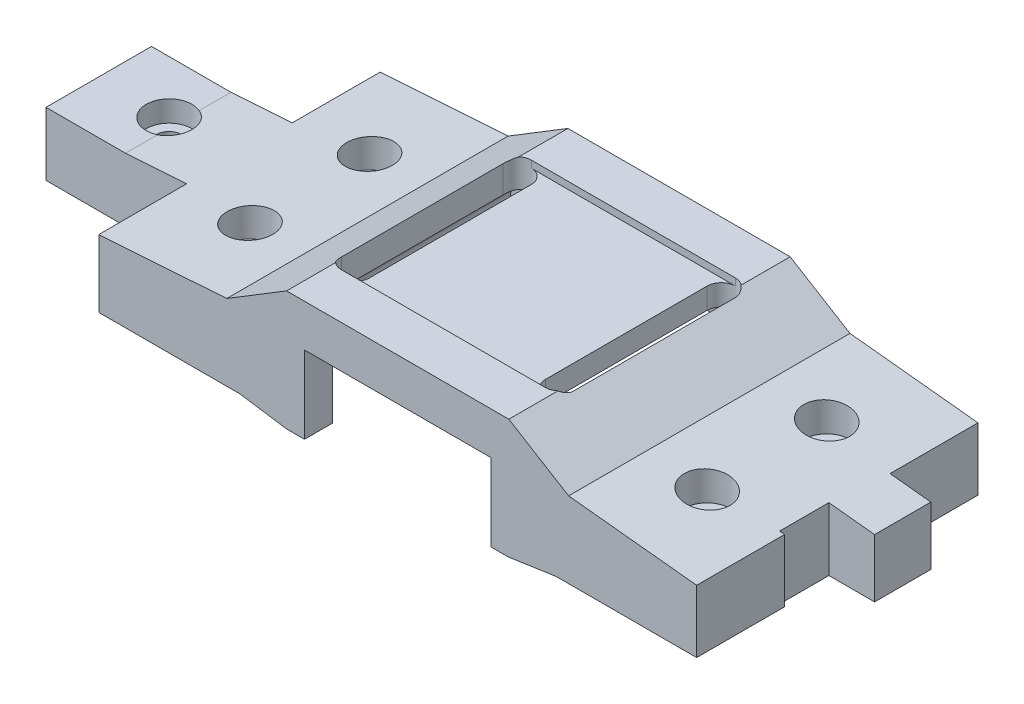
from build123d import *
from build123d.topology import SkipClean

# Parameters (mm, degrees)
SKETCH1_R                      = 1.8
BOSS_EXTRUDE1_DEPTH            = 6
BOSS_EXTRUDE2_REACH            = 76.446
CUT_EXTRUDE1_REACH             = 68.38
SKETCH3_R                      = 1.8
SKETCH3_W                      = 13.5
SKETCH3_H                      = 12.5
SKETCH4_R                      = 3.25
CUT_EXTRUDE2_DEPTH             = 10
CUT_EXTRUDE3_REACH             = 77.909
CUT_EXTRUDE4_START             = -2
SKETCH6_W                      = 35
SKETCH6_H                      = 27
CUT_EXTRUDE4_DEPTH             = 4.307692
FILLET1_R                      = 2
BOSS_EXTRUDE3_DEPTH            = 4
CUT_EXTRUDE5_REACH             = 68.897
CUT_EXTRUDE5_DIRECTION_2_REACH = 68.897
SKETCH9_W                      = 9.25
SKETCH9_H                      = 10
CUT_EXTRUDE6_DEPTH             = 32
SKETCH10_W                     = 29
SKETCH10_H                     = 27
CUT_EXTRUDE7_DEPTH             = 1
CUT_EXTRUDE8_DEPTH             = 67.379590252
CUT_EXTRUDE8_DEPTH_BACK        = 67.379590252
SKETCH11_W                     = 14.2
SKETCH11_H                     = 15
CUT_EXTRUDE9_REACH             = 69.544
SKETCH12_W                     = 6.5
SKETCH12_H                     = 7
CUT_EXTRUDE10_START            = -40
CUT_EXTRUDE10_DEPTH            = 40
BOSS_EXTRUDE4_START            = 3
BOSS_EXTRUDE4_DEPTH            = 3


with BuildPart() as part:
    # Sketch1 → Boss-Extrude1 (new body)
    with BuildSketch(Plane(origin=(0, 0, 0), x_dir=(1, 0, 0), z_dir=(0, 1, 0))):
        Polygon((42.5, 20), (42.5, 7.5), (62.5, 7.5), (62.5, -7.5), (42.5, -7.5), (42.5, -20), (-42.5, -20), (-42.5, -7.5), (-62.5, -7.5), (-62.5, 7.5), (-42.5, 7.5), (-42.5, 20), align=None)
        with Locations(Location((-52.5, 0, 0), (0, 0, 270))):
            Circle(SKETCH1_R, mode=Mode.SUBTRACT)
        with Locations(Location((-32.5, 8.5, 0), (0, 0, 270))):
            Circle(SKETCH1_R, mode=Mode.SUBTRACT)
        with Locations(Location((-32.5, -8.5, 0), (0, 0, 270))):
            Circle(SKETCH1_R, mode=Mode.SUBTRACT)
        with Locations(Location((32.5, -8.5, 0), (0, 0, 90))):
            Circle(SKETCH1_R, mode=Mode.SUBTRACT)
        with Locations(Location((52.5, 0, 0), (0, 0, 90))):
            Circle(SKETCH1_R, mode=Mode.SUBTRACT)
        with Locations(Location((32.5, 8.5, 0), (0, 0, 90))):
            Circle(SKETCH1_R, mode=Mode.SUBTRACT)
    extrude(amount=BOSS_EXTRUDE1_DEPTH)

    # Boss-Extrude2: up to this face of the body (flat: up to its plane)
    boss_extrude2_end = Plane(part.part.faces().sort_by_distance((0, 3, 20))[0])
    # Sketch2 → Boss-Extrude2 (add, up to the picked face)
    with BuildSketch(Plane(origin=(0, 0, -20), x_dir=(-1, 0, 0), z_dir=(0, 0, -1)), mode=Mode.PRIVATE) as boss_extrude2_sk1:
        Polygon((-56, 6), (-40, 16), (40, 16), (56, 6), align=None)
    boss_extrude2_tool1 = split(extrude(boss_extrude2_sk1.sketch, amount=-BOSS_EXTRUDE2_REACH, mode=Mode.PRIVATE), bisect_by=boss_extrude2_end, keep=Keep.BOTH, mode=Mode.PRIVATE)
    add(boss_extrude2_tool1.solids().sort_by(Axis((0, 10.722222, -20), (0, 0, 1)))[0])

    # Sketch3 → Cut-Extrude1 (cut, up to next)
    with BuildSketch(Plane.XZ.offset(-6), mode=Mode.PRIVATE) as cut_extrude1_sk1:
        with Locations(Location((52.5, 0, 0), (0, 0, 270))):
            Circle(SKETCH3_R)
    cut_extrude1_tool1 = extrude(cut_extrude1_sk1.sketch, amount=-CUT_EXTRUDE1_REACH, mode=Mode.PRIVATE) & part.part
    # Sketch3 → Cut-Extrude1 (cut, up to next)
    with BuildSketch(Plane.XZ.offset(-6), mode=Mode.PRIVATE) as cut_extrude1_sk2:
        with Locations(Location((32.5, -8.5, 0), (0, 0, 270))):
            Circle(SKETCH3_R)
    cut_extrude1_tool2 = extrude(cut_extrude1_sk2.sketch, amount=-CUT_EXTRUDE1_REACH, mode=Mode.PRIVATE) & part.part
    # Sketch3 → Cut-Extrude1 (cut, up to next)
    with BuildSketch(Plane.XZ.offset(-6), mode=Mode.PRIVATE) as cut_extrude1_sk3:
        with Locations(Location((32.5, 8.5, 0), (0, 0, 270))):
            Circle(SKETCH3_R)
    cut_extrude1_tool3 = extrude(cut_extrude1_sk3.sketch, amount=-CUT_EXTRUDE1_REACH, mode=Mode.PRIVATE) & part.part
    # Sketch3 → Cut-Extrude1 (cut, up to next)
    with BuildSketch(Plane.XZ.offset(-6), mode=Mode.PRIVATE) as cut_extrude1_sk4:
        with Locations(Location((-32.5, -8.5, 0), (0, 0, 90))):
            Circle(SKETCH3_R)
    cut_extrude1_tool4 = extrude(cut_extrude1_sk4.sketch, amount=-CUT_EXTRUDE1_REACH, mode=Mode.PRIVATE) & part.part
    # Sketch3 → Cut-Extrude1 (cut, up to next)
    with BuildSketch(Plane.XZ.offset(-6), mode=Mode.PRIVATE) as cut_extrude1_sk5:
        with Locations(Location((-52.5, 0, 0), (0, 0, 180))):
            Circle(SKETCH3_R)
    cut_extrude1_tool5 = extrude(cut_extrude1_sk5.sketch, amount=-CUT_EXTRUDE1_REACH, mode=Mode.PRIVATE) & part.part
    # Sketch3 → Cut-Extrude1 (cut, up to next)
    with BuildSketch(Plane.XZ.offset(-6), mode=Mode.PRIVATE) as cut_extrude1_sk6:
        with Locations(Location((-32.5, 8.5, 0), (0, 0, 90))):
            Circle(SKETCH3_R)
    cut_extrude1_tool6 = extrude(cut_extrude1_sk6.sketch, amount=-CUT_EXTRUDE1_REACH, mode=Mode.PRIVATE) & part.part
    # Sketch3 → Cut-Extrude1 (cut, up to next)
    with BuildSketch(Plane.XZ.offset(-6), mode=Mode.PRIVATE) as cut_extrude1_sk7:
        with Locations((-49.25, 13.75)):
            Rectangle(SKETCH3_W, SKETCH3_H)
    cut_extrude1_tool7 = extrude(cut_extrude1_sk7.sketch, amount=-CUT_EXTRUDE1_REACH, mode=Mode.PRIVATE) & part.part
    # Sketch3 → Cut-Extrude1 (cut, up to next)
    with BuildSketch(Plane.XZ.offset(-6), mode=Mode.PRIVATE) as cut_extrude1_sk8:
        with Locations((-49.25, -13.75)):
            Rectangle(SKETCH3_W, SKETCH3_H)
    cut_extrude1_tool8 = extrude(cut_extrude1_sk8.sketch, amount=-CUT_EXTRUDE1_REACH, mode=Mode.PRIVATE) & part.part
    # Sketch3 → Cut-Extrude1 (cut, up to next)
    with BuildSketch(Plane.XZ.offset(-6), mode=Mode.PRIVATE) as cut_extrude1_sk9:
        with Locations((49.25, -13.75)):
            Rectangle(SKETCH3_W, SKETCH3_H)
    cut_extrude1_tool9 = extrude(cut_extrude1_sk9.sketch, amount=-CUT_EXTRUDE1_REACH, mode=Mode.PRIVATE) & part.part
    # Sketch3 → Cut-Extrude1 (cut, up to next)
    with BuildSketch(Plane.XZ.offset(-6), mode=Mode.PRIVATE) as cut_extrude1_sk10:
        with Locations((49.25, 13.75)):
            Rectangle(SKETCH3_W, SKETCH3_H)
    cut_extrude1_tool10 = extrude(cut_extrude1_sk10.sketch, amount=-CUT_EXTRUDE1_REACH, mode=Mode.PRIVATE) & part.part
    add(cut_extrude1_tool1.solids().sort_by_distance((52.5, 6, 0))[0], mode=Mode.SUBTRACT)
    add(cut_extrude1_tool2.solids().sort_by_distance((32.5, 6, -8.5))[0], mode=Mode.SUBTRACT)
    add(cut_extrude1_tool3.solids().sort_by_distance((32.5, 6, 8.5))[0], mode=Mode.SUBTRACT)
    add(cut_extrude1_tool4.solids().sort_by_distance((-32.5, 6, -8.5))[0], mode=Mode.SUBTRACT)
    add(cut_extrude1_tool5.solids().sort_by_distance((-52.5, 6, 0))[0], mode=Mode.SUBTRACT)
    add(cut_extrude1_tool6.solids().sort_by_distance((-32.5, 6, 8.5))[0], mode=Mode.SUBTRACT)
    add(cut_extrude1_tool7.solids().sort_by_distance((-49.25, 6, 13.75))[0], mode=Mode.SUBTRACT)
    add(cut_extrude1_tool8.solids().sort_by_distance((-49.25, 6, -13.75))[0], mode=Mode.SUBTRACT)
    add(cut_extrude1_tool9.solids().sort_by_distance((49.25, 6, -13.75))[0], mode=Mode.SUBTRACT)
    add(cut_extrude1_tool10.solids().sort_by_distance((49.25, 6, 13.75))[0], mode=Mode.SUBTRACT)

    # Sketch4 → Cut-Extrude2 (cut)
    with BuildSketch(Plane(origin=(0, 16, 0), x_dir=(1, 0, 0), z_dir=(0, 1, 0))):
        with Locations(Location((-32.5, 8.5, 0), (0, 0, 270))):
            Circle(SKETCH4_R)
        with Locations(Location((-52.5, 0, 0), (0, 0, 270))):
            Circle(SKETCH4_R)
        with Locations(Location((-32.5, -8.5, 0), (0, 0, 270))):
            Circle(SKETCH4_R)
        with Locations(Location((32.5, 8.5, 0), (0, 0, 270))):
            Circle(SKETCH4_R)
        with Locations(Location((32.5, -8.5, 0), (0, 0, 270))):
            Circle(SKETCH4_R)
        with Locations(Location((52.5, 0, 0), (0, 0, 270))):
            Circle(SKETCH4_R)
    extrude(amount=-CUT_EXTRUDE2_DEPTH, mode=Mode.SUBTRACT)

    # Sketch5 → Cut-Extrude3 (cut, up to next)
    with BuildSketch(Plane(origin=(0, 0, -20), x_dir=(-1, 0, 0), z_dir=(0, 0, -1)), mode=Mode.PRIVATE) as cut_extrude3_sk1:
        Polygon((-22.5, 0), (-16, 10), (16, 10), (22.5, 0), align=None)
    cut_extrude3_tool1 = extrude(cut_extrude3_sk1.sketch, amount=-CUT_EXTRUDE3_REACH, mode=Mode.PRIVATE) & part.part
    add(cut_extrude3_tool1.solids().sort_by_distance((0, 4.718615, -20))[0], mode=Mode.SUBTRACT)

    # Sketch6 → Cut-Extrude4 (cut)
    with BuildSketch(Plane.XZ.offset(-10).offset(CUT_EXTRUDE4_START)):
        Rectangle(SKETCH6_W, SKETCH6_H)
    extrude(amount=CUT_EXTRUDE4_DEPTH, mode=Mode.SUBTRACT)

    # Fillet1
    fillet1_edges = [part.edges().sort_by_distance(p)[0] for p in [
        (-17.5, 12, 0),
        (17.5, 12, 0),
    ]]
    fillet(fillet1_edges, radius=FILLET1_R)

    # Sketch7 → Boss-Extrude3 (add)
    with BuildSketch(Plane(origin=(0, 0, -20), x_dir=(-1, 0, 0), z_dir=(0, 0, -1))):
        Polygon((-22.5, 0), (-15.75, -1), (-13.25, -1), (-13.25, 10), (-16, 10), align=None)
        Polygon((16, 10), (22.5, 0), (15.75, -1), (13.25, -1), (13.25, 10), align=None)
    boss_extrude3 = extrude(amount=-BOSS_EXTRUDE3_DEPTH)

    # Mirror1: Boss-Extrude3 across plane
    add(boss_extrude3.mirror(Plane.XY))

    # Sketch8 → Cut-Extrude5 (cut, up to next)
    with BuildSketch(Plane.XZ.offset(-12), mode=Mode.PRIVATE) as cut_extrude5_sk1:
        with BuildLine():
            Line((-12.5, 11.5), (-12.5, -11.5))
            ThreePointArc((-12.5, -11.5), (-14.5, -13.5), (-16.5, -11.5))
            Line((-16.5, -11.5), (-16.5, 11.5))
            ThreePointArc((-16.5, 11.5), (-14.5, 13.5), (-12.5, 11.5))
        make_face()
    cut_extrude5_tool1 = extrude(cut_extrude5_sk1.sketch, amount=-CUT_EXTRUDE5_REACH, mode=Mode.PRIVATE) & part.part
    # Sketch8 → Cut-Extrude5 (cut, up to next)
    with BuildSketch(Plane.XZ.offset(-12), mode=Mode.PRIVATE) as cut_extrude5_sk2:
        with BuildLine():
            Line((16.5, 11.5), (16.5, -11.5))
            ThreePointArc((16.5, -11.5), (14.5, -13.5), (12.5, -11.5))
            Line((12.5, -11.5), (12.5, 11.5))
            ThreePointArc((12.5, 11.5), (14.5, 13.5), (16.5, 11.5))
        make_face()
    cut_extrude5_tool2 = extrude(cut_extrude5_sk2.sketch, amount=-CUT_EXTRUDE5_REACH, mode=Mode.PRIVATE) & part.part
    add(cut_extrude5_tool1.solids().sort_by_distance((-14.5, 12, 0))[0], mode=Mode.SUBTRACT)
    add(cut_extrude5_tool2.solids().sort_by_distance((14.5, 12, 0))[0], mode=Mode.SUBTRACT)

    # Sketch8 → Cut-Extrude5 direction 2 (cut, up to next)
    with BuildSketch(Plane.XZ.offset(-12), mode=Mode.PRIVATE) as cut_extrude5_direction_2_sk1:
        with BuildLine():
            Line((-12.5, 11.5), (-12.5, -11.5))
            ThreePointArc((-12.5, -11.5), (-14.5, -13.5), (-16.5, -11.5))
            Line((-16.5, -11.5), (-16.5, 11.5))
            ThreePointArc((-16.5, 11.5), (-14.5, 13.5), (-12.5, 11.5))
        make_face()
    cut_extrude5_direction_2_tool1 = extrude(cut_extrude5_direction_2_sk1.sketch, amount=CUT_EXTRUDE5_DIRECTION_2_REACH, mode=Mode.PRIVATE) & part.part
    # Sketch8 → Cut-Extrude5 direction 2 (cut, up to next)
    with BuildSketch(Plane.XZ.offset(-12), mode=Mode.PRIVATE) as cut_extrude5_direction_2_sk2:
        with BuildLine():
            Line((16.5, 11.5), (16.5, -11.5))
            ThreePointArc((16.5, -11.5), (14.5, -13.5), (12.5, -11.5))
            Line((12.5, -11.5), (12.5, 11.5))
            ThreePointArc((12.5, 11.5), (14.5, 13.5), (16.5, 11.5))
        make_face()
    cut_extrude5_direction_2_tool2 = extrude(cut_extrude5_direction_2_sk2.sketch, amount=CUT_EXTRUDE5_DIRECTION_2_REACH, mode=Mode.PRIVATE) & part.part
    add(cut_extrude5_direction_2_tool1.solids().sort_by_distance((-14.5, 12, 0))[0], mode=Mode.SUBTRACT)
    add(cut_extrude5_direction_2_tool2.solids().sort_by_distance((14.5, 12, 0))[0], mode=Mode.SUBTRACT)

    # Sketch9 → Cut-Extrude6 (cut)
    with BuildSketch(Plane(origin=(0, 0, 16), x_dir=(-1, 0, 0), z_dir=(0, 0, -1))):
        with Locations((-17.875, 5)):
            Rectangle(SKETCH9_W, SKETCH9_H)
    extrude(amount=CUT_EXTRUDE6_DEPTH, mode=Mode.SUBTRACT)

    # Sketch10 → Cut-Extrude7 (cut)
    with BuildSketch(Plane(origin=(0, 16, 0), x_dir=(1, 0, 0), z_dir=(0, 1, 0))):
        Rectangle(SKETCH10_W, SKETCH10_H)
    extrude(amount=-CUT_EXTRUDE7_DEPTH, mode=Mode.SUBTRACT)

    # Sketch11 → Cut-Extrude8 (cut, two sides: drawn at the far end of the back side and taken through both)
    with BuildSketch(Plane(origin=(0, 6, 0), x_dir=(1, 0, 0), z_dir=(0, 1, 0)).offset(-CUT_EXTRUDE8_DEPTH_BACK)):
        with Locations((55.4, 0)):
            Rectangle(SKETCH11_W, SKETCH11_H)
    extrude(amount=CUT_EXTRUDE8_DEPTH + CUT_EXTRUDE8_DEPTH_BACK, mode=Mode.SUBTRACT)

    # Cut-Extrude9: up to this plane
    cut_extrude9_end = Plane(origin=(56, 6, 132.445542375), z_dir=(0.52999894000318, 0.847998304005088, 0))
    # Sketch12 → Cut-Extrude9 (cut, up to the surface)
    with BuildSketch(Plane.XZ, mode=Mode.PRIVATE) as cut_extrude9_sk1:
        with Locations((45.05, 4)):
            Rectangle(SKETCH12_W, SKETCH12_H)
    cut_extrude9_tool1 = split(extrude(cut_extrude9_sk1.sketch, amount=-CUT_EXTRUDE9_REACH, mode=Mode.PRIVATE), bisect_by=cut_extrude9_end, keep=Keep.BOTH, mode=Mode.PRIVATE)
    add(cut_extrude9_tool1.solids().sort_by_distance((45.05, 0, 4))[0], mode=Mode.SUBTRACT)

    # Sketch13 → Cut-Extrude10 (cut)
    with BuildSketch(Plane.XY.offset(20).offset(CUT_EXTRUDE10_START)):
        Polygon((48.3, 8.297158643), (24.3, 10.8125), (15.8, 16), (-15.8, 16), (-24.3, 10.8125), (-51.2, 9), (-40, 16), (0, 23.828443465), (40, 16), (48.3, 10.8125), align=None)
    extrude(amount=CUT_EXTRUDE10_DEPTH, mode=Mode.SUBTRACT)

    # Sketch14 → Boss-Extrude4 (add)
    with BuildSketch(Plane(origin=(0, 6, 0), x_dir=(1, 0, 0), z_dir=(0, 1, 0)).offset(BOSS_EXTRUDE4_START)):
        with BuildLine():
            Line((-62.5, 7.5), (-51.2, 7.5))
            Line((-51.2, 7.5), (-51.2, 2.978674202))
            ThreePointArc((-51.2, 2.978674202), (-55.75, 0), (-51.2, -2.978674202))
            Line((-51.2, -2.978674202), (-51.2, -7.5))
            Line((-51.2, -7.5), (-62.5, -7.5))
            Line((-62.5, -7.5), (-62.5, 7.5))
        make_face()
    extrude(amount=-BOSS_EXTRUDE4_DEPTH)


solid = part.part
